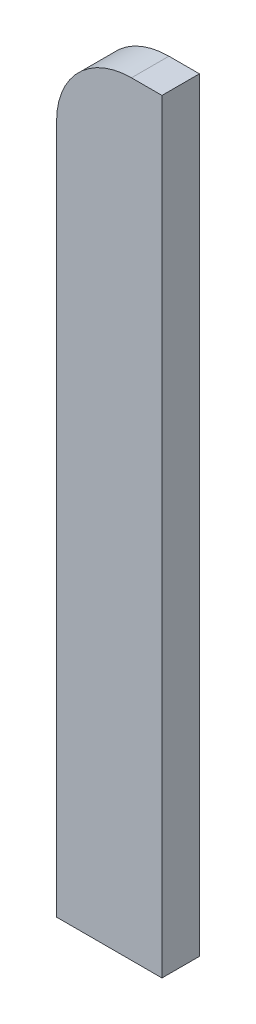
from build123d import *

# Parameters (mm, degrees)
SKETCH1_W           = 14.072
SKETCH1_H           = 102.059
BOSS_EXTRUDE1_DEPTH = 5
FILLET1_R           = 10


with BuildPart() as part:
    # Sketch1 → Boss-Extrude1 (new body)
    with BuildSketch(Plane.XY):
        with Locations((14.072, 118.5105)):
            Rectangle(SKETCH1_W, SKETCH1_H)
    extrude(amount=BOSS_EXTRUDE1_DEPTH)

    # Fillet1
    fillet1_edges = [part.edges().sort_by_distance(p)[0] for p in [
        (7.036, 169.54, 2.5),
    ]]
    fillet(fillet1_edges, radius=FILLET1_R)


solid = part.part
